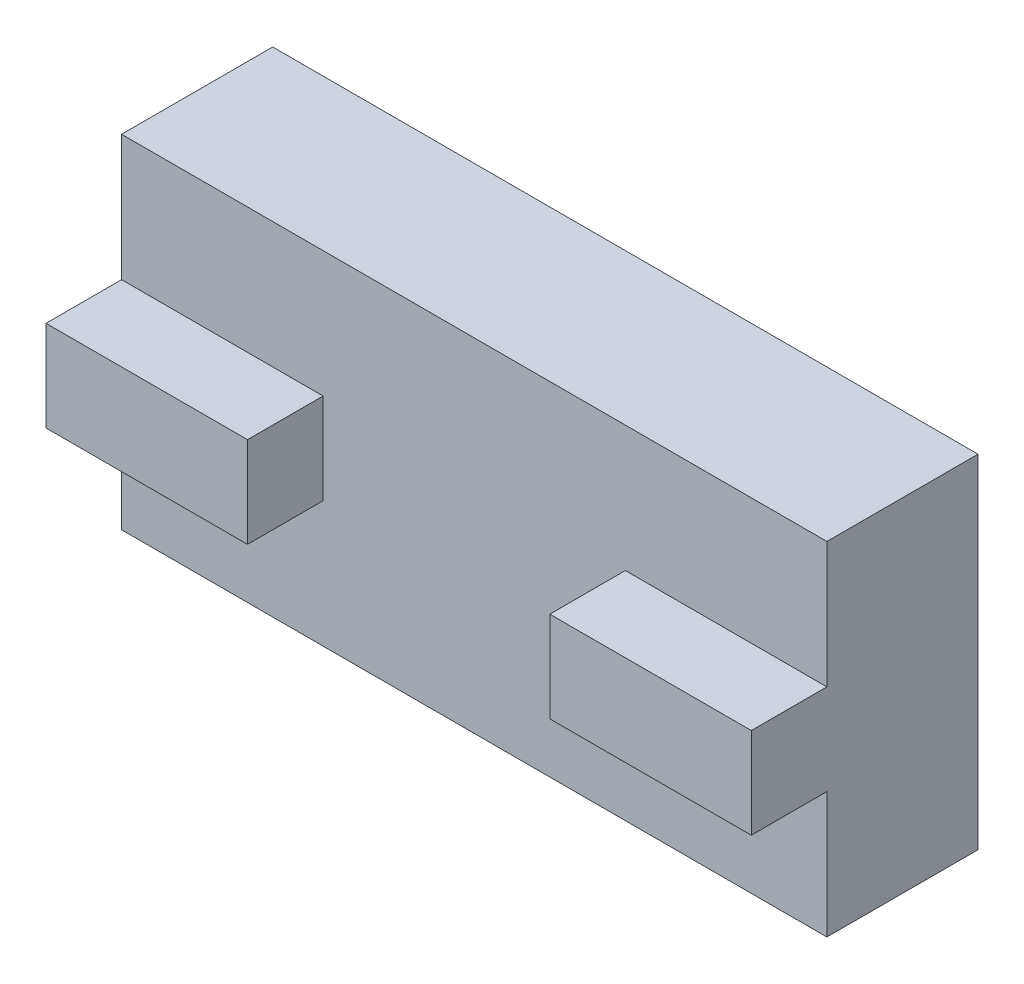
from build123d import *

# Parameters (mm, degrees)
SKETCH1_W           = 700
SKETCH1_H           = 340
BASE_EXTRUDE_DEPTH  = 150
SKETCH2_W           = 700
SKETCH2_H           = 90
BOSS_EXTRUDE1_DEPTH = 75
SKETCH3_W           = 300
SKETCH3_H           = 100
CUT_EXTRUDE1_DEPTH  = 75


with BuildPart() as part:
    # Sketch1 → Base-Extrude (new body)
    with BuildSketch(Plane.XY):
        with Locations((-150, 70)):
            Rectangle(SKETCH1_W, SKETCH1_H)
    extrude(amount=BASE_EXTRUDE_DEPTH)

    # Sketch2 → Boss-Extrude1 (add)
    with BuildSketch(Plane.XY.offset(150)):
        with Locations((-150, 70)):
            Rectangle(SKETCH2_W, SKETCH2_H)
    extrude(amount=BOSS_EXTRUDE1_DEPTH)

    # Sketch3 → Cut-Extrude1 (cut)
    with BuildSketch(Plane.XY.offset(225)):
        with Locations((-150, 70)):
            Rectangle(SKETCH3_W, SKETCH3_H)
    extrude(amount=-CUT_EXTRUDE1_DEPTH, mode=Mode.SUBTRACT)


solid = part.part
